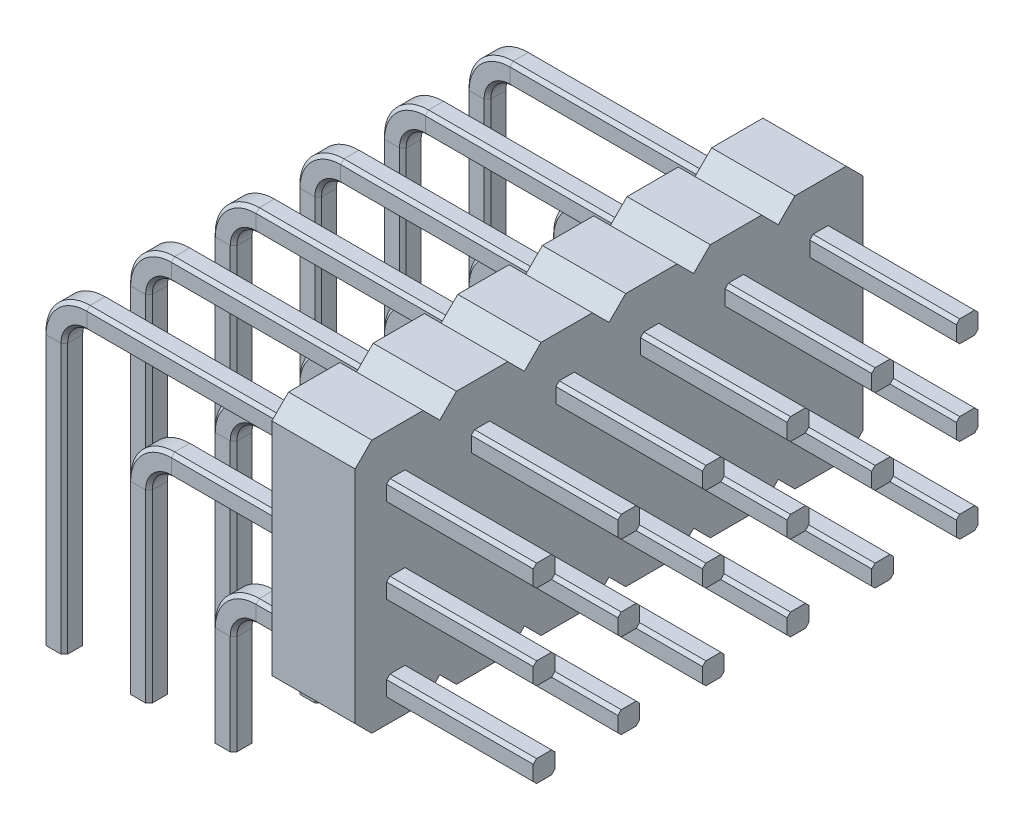
from build123d import *

# Parameters (mm, degrees)
BOSS_EXTRUDE1_DEPTH = 2.5
LPATTERN1_COUNT     = 6
LPATTERN1_PITCH     = 2.54


with BuildPart() as part:
    # Sweep2: sweep along a path in Sketch2
    with BuildLine(Plane.XY) as sweep2_path:
        Line((5.08, 0), (5.08, 3))
        ThreePointArc((5.08, 3), (5.372893219, 3.707106781), (6.08, 4))
        Line((6.08, 4), (14.4, 4))
    # Sketch1 → Sweep2 (sweep)
    with BuildSketch(Plane(origin=(0, 0, 0), x_dir=(1, 0, 0), z_dir=(0, 1, 0))):
        Polygon((5.305, 0.325), (4.855, 0.325), (4.755, 0.225), (4.755, -0.225), (4.855, -0.325), (5.305, -0.325), (5.405, -0.225), (5.405, 0.225), align=None)
    sweep(path=sweep2_path.line)



with BuildPart() as body_2:
    # Sweep3: sweep along a path in Sketch2<7>
    with BuildLine(Plane.XY) as sweep3_path:
        Line((2.54, 0), (2.54, 5.54))
        ThreePointArc((2.54, 5.54), (2.832893219, 6.247106781), (3.54, 6.54))
        Line((3.54, 6.54), (14.4, 6.54))
    # Sketch1<9> → Sweep3 (sweep)
    with BuildSketch(Plane(origin=(0, 0, 0), x_dir=(1, 0, 0), z_dir=(0, 1, 0))):
        Polygon((2.765, 0.325), (2.315, 0.325), (2.215, 0.225), (2.215, -0.225), (2.315, -0.325), (2.765, -0.325), (2.865, -0.225), (2.865, 0.225), align=None)
    sweep(path=sweep3_path.line)


with BuildPart() as body_3:
    # Sweep4: sweep along a path in Sketch2<8>
    with BuildLine(Plane.XY) as sweep4_path:
        Line((0, 0), (0, 8.08))
        ThreePointArc((0, 8.08), (0.292893219, 8.787106781), (1, 9.08))
        Line((1, 9.08), (14.4, 9.08))
    # Sketch1<10> → Sweep4 (sweep)
    with BuildSketch(Plane(origin=(0, 0, 0), x_dir=(1, 0, 0), z_dir=(0, 1, 0))):
        Polygon((-0.225, 0.325), (-0.325, 0.225), (-0.325, -0.225), (-0.225, -0.325), (0.225, -0.325), (0.325, -0.225), (0.325, 0.225), (0.225, 0.325), align=None)
    sweep(path=sweep4_path.line)


with BuildPart() as part_1:
    add(part.part)

    add(body_2.part)  # Boss-Extrude1 merges body 2

    add(body_3.part)  # Boss-Extrude1 merges body 3
    # Sketch5 → Boss-Extrude1 (add)
    with BuildSketch(Plane(origin=(7.5, 0, 0), x_dir=(0, 0, -1), z_dir=(1, 0, 0))):
        Polygon((-0.77, 3.055), (0.77, 3.055), (1.27, 3.555), (1.27, 10.175), (0.77, 10.675), (-0.77, 10.675), (-1.27, 10.175), (-1.27, 3.555), align=None)
    extrude(amount=BOSS_EXTRUDE1_DEPTH)


with BuildPart() as lpattern1_1:
    # LPattern1: pattern copy
    add(part_1.part.moved(Location(Vector(0, 0, 1) * (1 * LPATTERN1_PITCH))))


with BuildPart() as lpattern1_2:
    # LPattern1: pattern copy
    add(part_1.part.moved(Location(Vector(0, 0, 1) * (2 * LPATTERN1_PITCH))))


with BuildPart() as lpattern1_3:
    # LPattern1: pattern copy
    add(part_1.part.moved(Location(Vector(0, 0, 1) * (3 * LPATTERN1_PITCH))))


with BuildPart() as lpattern1_4:
    # LPattern1: pattern copy
    add(part_1.part.moved(Location(Vector(0, 0, 1) * (4 * LPATTERN1_PITCH))))


with BuildPart() as lpattern1_5:
    # LPattern1: pattern copy
    add(part_1.part.moved(Location(Vector(0, 0, 1) * (5 * LPATTERN1_PITCH))))


with BuildPart() as part_2:
    add(part_1.part)

    # Combine1: union LPattern1_1, LPattern1_2, LPattern1_3, LPattern1_4, LPattern1_5
    add(lpattern1_1.part)
    add(lpattern1_2.part)
    add(lpattern1_3.part)
    add(lpattern1_4.part)
    add(lpattern1_5.part)


solid = part_2.part
